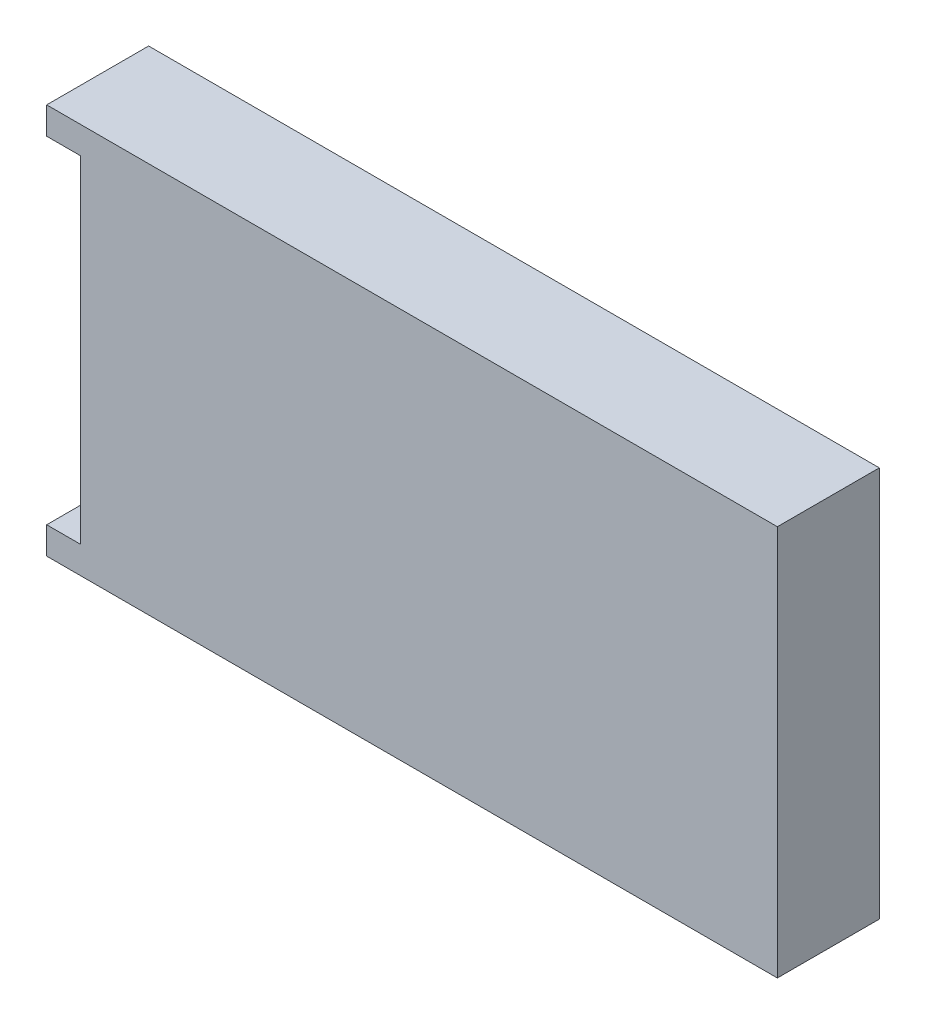
from build123d import *

# Parameters (mm, degrees)
SKETCH_1_W          = 215
SKETCH_1_H          = 115
EXTRUDE_1_DEPTH     = 30
SKETCH_2_W          = 10
SKETCH_2_H          = 99
CUT_EXTRUDE_1_DEPTH = 15


with BuildPart() as part:
    # 草圖1 → 填料-伸長1 (new body)
    with BuildSketch(Plane.XY):
        Rectangle(SKETCH_1_W, SKETCH_1_H)
    extrude(amount=EXTRUDE_1_DEPTH)

    # 草圖2 → 除料-伸長1 (cut)
    with BuildSketch(Plane.XY.offset(30)):
        with Locations((-102.5, 0)):
            Rectangle(SKETCH_2_W, SKETCH_2_H)
    extrude(amount=-CUT_EXTRUDE_1_DEPTH, mode=Mode.SUBTRACT)


solid = part.part
